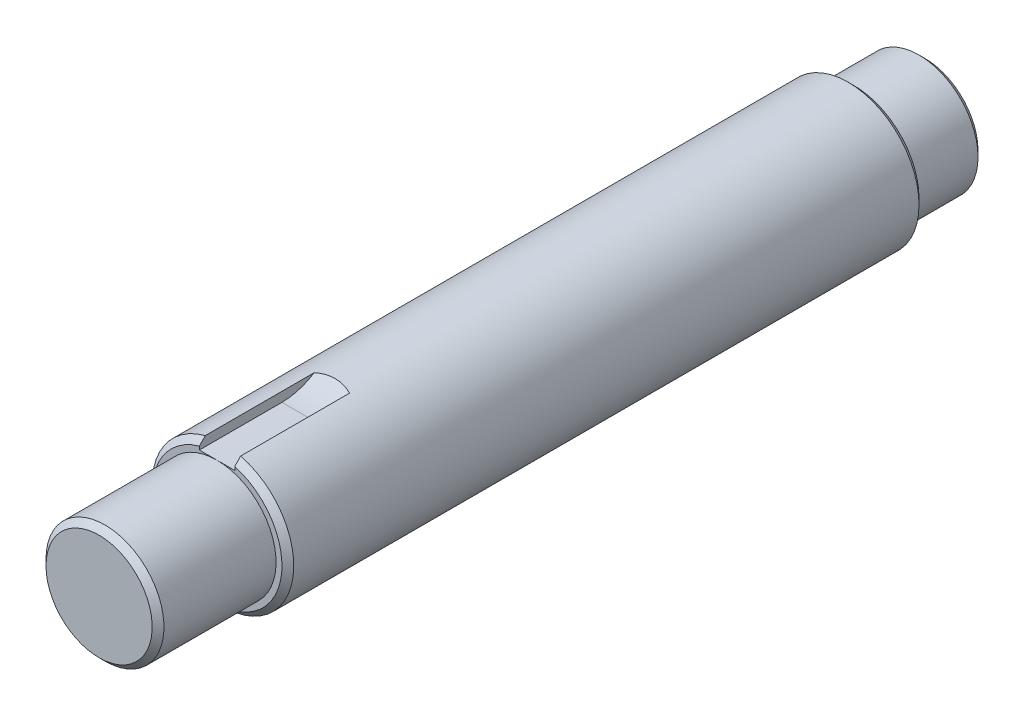
from build123d import *

# Parameters (mm, degrees)
ESQUISSE1_R             = 5
BASE_EXTRUSION_DEPTH    = 6
ESQUISSE2_R             = 6
BOSS_EXTRU_1_DEPTH      = 54
ESQUISSE3_R             = 5
BOSS_EXTRU_2_DEPTH      = 10
CHANFREIN1_SIZE         = 0.5
ENL_V_MAT_EXTRU_1_DEPTH = 1.5


with BuildPart() as part:
    # Esquisse1 → Base-Extrusion (new body)
    with BuildSketch(Plane.XY):
        with Locations(Location((0, 0, 0), (0, 0, 180))):
            Circle(ESQUISSE1_R)
    extrude(amount=BASE_EXTRUSION_DEPTH)

    # Esquisse2 → Boss.-Extru.1 (add)
    with BuildSketch(Plane.XY.offset(6)):
        with Locations(Location((0, 0, 0), (0, 0, 104.477512186))):
            Circle(ESQUISSE2_R)
    extrude(amount=BOSS_EXTRU_1_DEPTH)

    # Esquisse3 → Boss.-Extru.2 (add)
    with BuildSketch(Plane.XY.offset(60)):
        with Locations(Location((0, 0, 0), (0, 0, 180))):
            Circle(ESQUISSE3_R)
    extrude(amount=BOSS_EXTRU_2_DEPTH)

    # Chanfrein1
    chanfrein1_edges = [part.edges().sort_by_distance(p)[0] for p in [
        (1.5, -5.809475019, 6),
        (1.5, -5.809475019, 60),
        (5, 0, 0),
        (5, 0, 70),
    ]]
    chamfer(chanfrein1_edges, length=CHANFREIN1_SIZE)

    # Esquisse5 → Enlèv. mat.-Extru.1 (cut, symmetric)
    with BuildSketch(Plane(origin=(0, 0, 0), x_dir=(0, 0, -1), z_dir=(1, 0, 0))):
        with BuildLine():
            Line((-60, 5), (-53, 5))
            ThreePointArc((-53, 5), (-49.464466094, 13.535533906), (-58, 10))
            Line((-58, 10), (-60, 10))
            Line((-60, 10), (-60, 5))
        make_face()
    extrude(amount=ENL_V_MAT_EXTRU_1_DEPTH, both=True, mode=Mode.SUBTRACT)


solid = part.part
